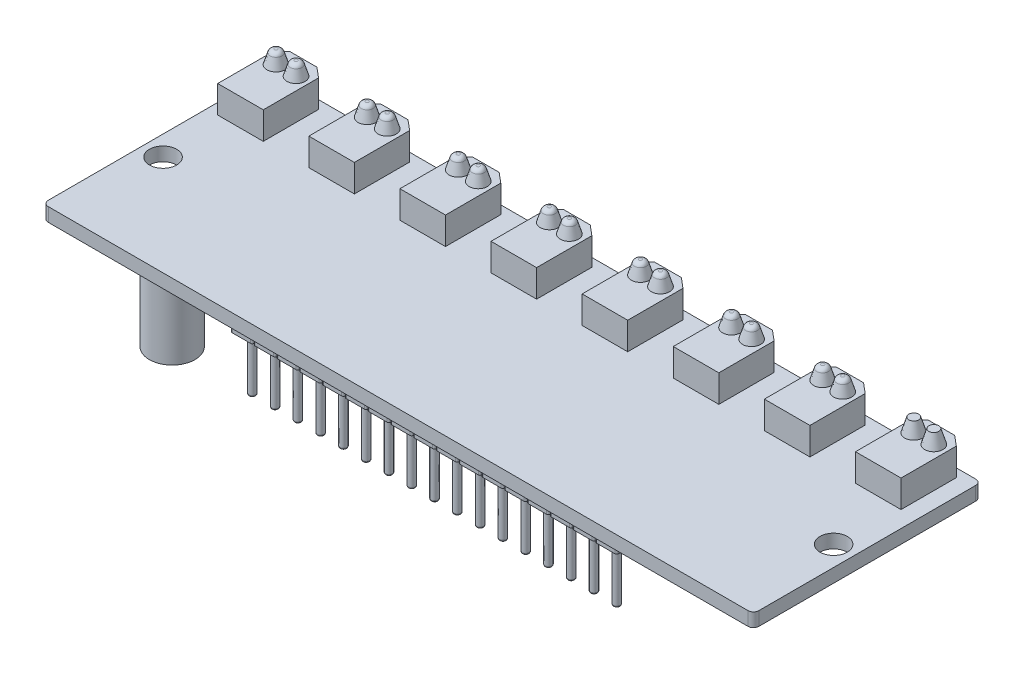
from build123d import *

# Parameters (mm, degrees)
SKETCH1_W                      = 78
SKETCH1_H                      = 25
BOSS_EXTRUDE1_DEPTH            = 1.5
FILLET1_R                      = 0.6
SKETCH2_R                      = 1.5
CUT_EXTRUDE1_DEPTH             = 1.5
BOSS_EXTRUDE2_DEPTH            = 3
SKETCH4_R                      = 1
BOSS_EXTRUDE7_DEPTH            = 1.5
BOSS_EXTRUDE7_DRAFT            = 17
BOSS_EXTRUDE7_PROFILE_2_DEPTH  = 1.5
BOSS_EXTRUDE7_PROFILE_2_DRAFT  = 17
BOSS_EXTRUDE7_PROFILE_3_DEPTH  = 1.5
BOSS_EXTRUDE7_PROFILE_3_DRAFT  = 17
BOSS_EXTRUDE7_PROFILE_4_DEPTH  = 1.5
BOSS_EXTRUDE7_PROFILE_4_DRAFT  = 17
BOSS_EXTRUDE7_PROFILE_5_DEPTH  = 1.5
BOSS_EXTRUDE7_PROFILE_5_DRAFT  = 17
BOSS_EXTRUDE7_PROFILE_6_DEPTH  = 1.5
BOSS_EXTRUDE7_PROFILE_6_DRAFT  = 17
BOSS_EXTRUDE7_PROFILE_7_DEPTH  = 1.5
BOSS_EXTRUDE7_PROFILE_7_DRAFT  = 17
BOSS_EXTRUDE7_PROFILE_8_DEPTH  = 1.5
BOSS_EXTRUDE7_PROFILE_8_DRAFT  = 17
BOSS_EXTRUDE7_PROFILE_9_DEPTH  = 1.5
BOSS_EXTRUDE7_PROFILE_9_DRAFT  = 17
BOSS_EXTRUDE7_PROFILE_10_DEPTH = 1.5
BOSS_EXTRUDE7_PROFILE_10_DRAFT = 17
BOSS_EXTRUDE7_PROFILE_11_DEPTH = 1.5
BOSS_EXTRUDE7_PROFILE_11_DRAFT = 17
BOSS_EXTRUDE7_PROFILE_12_DEPTH = 1.5
BOSS_EXTRUDE7_PROFILE_12_DRAFT = 17
BOSS_EXTRUDE7_PROFILE_13_DEPTH = 1.5
BOSS_EXTRUDE7_PROFILE_13_DRAFT = 17
BOSS_EXTRUDE7_PROFILE_14_DEPTH = 1.5
BOSS_EXTRUDE7_PROFILE_14_DRAFT = 17
BOSS_EXTRUDE7_PROFILE_15_DEPTH = 1.5
BOSS_EXTRUDE7_PROFILE_15_DRAFT = 17
BOSS_EXTRUDE7_PROFILE_16_DEPTH = 1.5
BOSS_EXTRUDE7_PROFILE_16_DRAFT = 17
FILLET4_R                      = 0.5
SKETCH5_W                      = 2.4
SKETCH5_H                      = 2.4
BOSS_EXTRUDE12_DEPTH           = 2
SKETCH6_R                      = 0.375
BOSS_EXTRUDE13_DEPTH           = 6
FILLET5_R                      = 0.2
FILLET7_R                      = 0.2
FILLET8_R                      = 0.2
SKETCH7_R                      = 2.5
BOSS_EXTRUDE14_DEPTH           = 10


with BuildPart() as part:
    # Sketch1 → Boss-Extrude1 (new body)
    with BuildSketch(Plane(origin=(0, 0, 0), x_dir=(1, 0, 0), z_dir=(0, 1, 0))):
        Rectangle(SKETCH1_W, SKETCH1_H)
    extrude(amount=BOSS_EXTRUDE1_DEPTH)

    # Fillet1
    fillet1_edges = [part.edges().sort_by_distance(p)[0] for p in [
        (-39, 0.75, -12.5),
        (39, 0.75, -12.5),
        (39, 0.75, 12.5),
        (-39, 0.75, 12.5),
    ]]
    fillet(fillet1_edges, radius=FILLET1_R)

    # Sketch2 → Cut-Extrude1 (cut)
    with BuildSketch(Plane(origin=(0, 1.5, 0), x_dir=(1, 0, 0), z_dir=(0, 1, 0))):
        with Locations(Location((-36.8, -1.5, 0), (0, 0, 270))):
            Circle(SKETCH2_R)
        with Locations(Location((36.8, -1.5, 0), (0, 0, 90))):
            Circle(SKETCH2_R)
    extrude(amount=-CUT_EXTRUDE1_DEPTH, mode=Mode.SUBTRACT)

    # Sketch3 → Boss-Extrude2 (add)
    with BuildSketch(Plane(origin=(0, 1.5, 0), x_dir=(1, 0, 0), z_dir=(0, 1, 0))):
        Polygon((-36.866761268, 12.5), (-33.913958089, 12.5), (-32.8, 11.566761268), (-32.8, 5.5), (-37.8, 5.5), (-37.8, 11.566761268), align=None)
        Polygon((-22.8, 11.566761268), (-22.8, 5.5), (-27.8, 5.5), (-27.8, 11.566761268), (-26.866761268, 12.5), (-23.913958089, 12.5), align=None)
        Polygon((-12.8, 11.566761268), (-12.8, 5.5), (-17.8, 5.5), (-17.8, 11.566761268), (-16.866761268, 12.5), (-13.913958089, 12.5), align=None)
        Polygon((-2.8, 11.566761268), (-2.8, 5.5), (-7.8, 5.5), (-7.8, 11.566761268), (-6.866761268, 12.5), (-3.913958089, 12.5), align=None)
        Polygon((7.2, 11.566761268), (7.2, 5.5), (2.2, 5.5), (2.2, 11.566761268), (3.133238732, 12.5), (6.086041911, 12.5), align=None)
        Polygon((17.2, 11.566761268), (17.2, 5.5), (12.2, 5.5), (12.2, 11.566761268), (13.133238732, 12.5), (16.086041911, 12.5), align=None)
        Polygon((27.2, 11.566761268), (27.2, 5.5), (22.2, 5.5), (22.2, 11.566761268), (23.133238732, 12.5), (26.086041911, 12.5), align=None)
        Polygon((37.2, 11.566761268), (37.2, 5.5), (32.2, 5.5), (32.2, 11.566761268), (33.133238732, 12.5), (36.086041911, 12.5), align=None)
    extrude(amount=BOSS_EXTRUDE2_DEPTH)


with BuildPart() as boss_extrude7_tool:
    # Sketch4 → Boss-Extrude7 (with draft: the straight prism first)
    with BuildSketch(Plane(origin=(0, 4.5, 0), x_dir=(1, 0, 0), z_dir=(0, 1, 0))):
        with Locations((-36.4, 10.499601384)):
            Circle(SKETCH4_R)
    extrude(amount=BOSS_EXTRUDE7_DEPTH)
    # Boss-Extrude7: the draft: its side faces are tilted about the plane it starts from
    boss_extrude7_sides = [boss_extrude7_tool.faces().sort_by_distance(p)[0] for p in [
        (-37.4, 5.25, -10.499601384),
    ]]
    draft(boss_extrude7_sides, Plane(origin=(0, 4.5, 0), x_dir=(1, 0, 0), z_dir=(0, 1, 0)), BOSS_EXTRUDE7_DRAFT)


with BuildPart() as part_1:
    add(part.part)

    # Boss-Extrude7: add boss_extrude7_tool
    add(boss_extrude7_tool.part)


with BuildPart() as boss_extrude7_profile_2_tool:
    # Sketch4 → Boss-Extrude7 profile 2 (with draft: the straight prism first)
    with BuildSketch(Plane(origin=(0, 4.5, 0), x_dir=(1, 0, 0), z_dir=(0, 1, 0))):
        with Locations((-34.2, 10.499601384)):
            Circle(SKETCH4_R)
    extrude(amount=BOSS_EXTRUDE7_PROFILE_2_DEPTH)
    # Boss-Extrude7 profile 2: the draft: its side faces are tilted about the plane it starts from
    boss_extrude7_profile_2_sides = [boss_extrude7_profile_2_tool.faces().sort_by_distance(p)[0] for p in [
        (-35.2, 5.25, -10.499601384),
    ]]
    draft(boss_extrude7_profile_2_sides, Plane(origin=(0, 4.5, 0), x_dir=(1, 0, 0), z_dir=(0, 1, 0)), BOSS_EXTRUDE7_PROFILE_2_DRAFT)


with BuildPart() as part_2:
    add(part_1.part)

    # Boss-Extrude7 profile 2: add boss_extrude7_profile_2_tool
    add(boss_extrude7_profile_2_tool.part)


with BuildPart() as boss_extrude7_profile_3_tool:
    # Sketch4 → Boss-Extrude7 profile 3 (with draft: the straight prism first)
    with BuildSketch(Plane(origin=(0, 4.5, 0), x_dir=(1, 0, 0), z_dir=(0, 1, 0))):
        with Locations((-26.4, 10.499601384)):
            Circle(SKETCH4_R)
    extrude(amount=BOSS_EXTRUDE7_PROFILE_3_DEPTH)
    # Boss-Extrude7 profile 3: the draft: its side faces are tilted about the plane it starts from
    boss_extrude7_profile_3_sides = [boss_extrude7_profile_3_tool.faces().sort_by_distance(p)[0] for p in [
        (-27.4, 5.25, -10.499601384),
    ]]
    draft(boss_extrude7_profile_3_sides, Plane(origin=(0, 4.5, 0), x_dir=(1, 0, 0), z_dir=(0, 1, 0)), BOSS_EXTRUDE7_PROFILE_3_DRAFT)


with BuildPart() as part_3:
    add(part_2.part)

    # Boss-Extrude7 profile 3: add boss_extrude7_profile_3_tool
    add(boss_extrude7_profile_3_tool.part)


with BuildPart() as boss_extrude7_profile_4_tool:
    # Sketch4 → Boss-Extrude7 profile 4 (with draft: the straight prism first)
    with BuildSketch(Plane(origin=(0, 4.5, 0), x_dir=(1, 0, 0), z_dir=(0, 1, 0))):
        with Locations((-24.2, 10.499601384)):
            Circle(SKETCH4_R)
    extrude(amount=BOSS_EXTRUDE7_PROFILE_4_DEPTH)
    # Boss-Extrude7 profile 4: the draft: its side faces are tilted about the plane it starts from
    boss_extrude7_profile_4_sides = [boss_extrude7_profile_4_tool.faces().sort_by_distance(p)[0] for p in [
        (-25.2, 5.25, -10.499601384),
    ]]
    draft(boss_extrude7_profile_4_sides, Plane(origin=(0, 4.5, 0), x_dir=(1, 0, 0), z_dir=(0, 1, 0)), BOSS_EXTRUDE7_PROFILE_4_DRAFT)


with BuildPart() as part_4:
    add(part_3.part)

    # Boss-Extrude7 profile 4: add boss_extrude7_profile_4_tool
    add(boss_extrude7_profile_4_tool.part)


with BuildPart() as boss_extrude7_profile_5_tool:
    # Sketch4 → Boss-Extrude7 profile 5 (with draft: the straight prism first)
    with BuildSketch(Plane(origin=(0, 4.5, 0), x_dir=(1, 0, 0), z_dir=(0, 1, 0))):
        with Locations((-16.4, 10.499601384)):
            Circle(SKETCH4_R)
    extrude(amount=BOSS_EXTRUDE7_PROFILE_5_DEPTH)
    # Boss-Extrude7 profile 5: the draft: its side faces are tilted about the plane it starts from
    boss_extrude7_profile_5_sides = [boss_extrude7_profile_5_tool.faces().sort_by_distance(p)[0] for p in [
        (-17.4, 5.25, -10.499601384),
    ]]
    draft(boss_extrude7_profile_5_sides, Plane(origin=(0, 4.5, 0), x_dir=(1, 0, 0), z_dir=(0, 1, 0)), BOSS_EXTRUDE7_PROFILE_5_DRAFT)


with BuildPart() as part_5:
    add(part_4.part)

    # Boss-Extrude7 profile 5: add boss_extrude7_profile_5_tool
    add(boss_extrude7_profile_5_tool.part)


with BuildPart() as boss_extrude7_profile_6_tool:
    # Sketch4 → Boss-Extrude7 profile 6 (with draft: the straight prism first)
    with BuildSketch(Plane(origin=(0, 4.5, 0), x_dir=(1, 0, 0), z_dir=(0, 1, 0))):
        with Locations((-14.2, 10.499601384)):
            Circle(SKETCH4_R)
    extrude(amount=BOSS_EXTRUDE7_PROFILE_6_DEPTH)
    # Boss-Extrude7 profile 6: the draft: its side faces are tilted about the plane it starts from
    boss_extrude7_profile_6_sides = [boss_extrude7_profile_6_tool.faces().sort_by_distance(p)[0] for p in [
        (-15.2, 5.25, -10.499601384),
    ]]
    draft(boss_extrude7_profile_6_sides, Plane(origin=(0, 4.5, 0), x_dir=(1, 0, 0), z_dir=(0, 1, 0)), BOSS_EXTRUDE7_PROFILE_6_DRAFT)


with BuildPart() as part_6:
    add(part_5.part)

    # Boss-Extrude7 profile 6: add boss_extrude7_profile_6_tool
    add(boss_extrude7_profile_6_tool.part)


with BuildPart() as boss_extrude7_profile_7_tool:
    # Sketch4 → Boss-Extrude7 profile 7 (with draft: the straight prism first)
    with BuildSketch(Plane(origin=(0, 4.5, 0), x_dir=(1, 0, 0), z_dir=(0, 1, 0))):
        with Locations((-6.4, 10.499601384)):
            Circle(SKETCH4_R)
    extrude(amount=BOSS_EXTRUDE7_PROFILE_7_DEPTH)
    # Boss-Extrude7 profile 7: the draft: its side faces are tilted about the plane it starts from
    boss_extrude7_profile_7_sides = [boss_extrude7_profile_7_tool.faces().sort_by_distance(p)[0] for p in [
        (-7.4, 5.25, -10.499601384),
    ]]
    draft(boss_extrude7_profile_7_sides, Plane(origin=(0, 4.5, 0), x_dir=(1, 0, 0), z_dir=(0, 1, 0)), BOSS_EXTRUDE7_PROFILE_7_DRAFT)


with BuildPart() as part_7:
    add(part_6.part)

    # Boss-Extrude7 profile 7: add boss_extrude7_profile_7_tool
    add(boss_extrude7_profile_7_tool.part)


with BuildPart() as boss_extrude7_profile_8_tool:
    # Sketch4 → Boss-Extrude7 profile 8 (with draft: the straight prism first)
    with BuildSketch(Plane(origin=(0, 4.5, 0), x_dir=(1, 0, 0), z_dir=(0, 1, 0))):
        with Locations((-4.2, 10.499601384)):
            Circle(SKETCH4_R)
    extrude(amount=BOSS_EXTRUDE7_PROFILE_8_DEPTH)
    # Boss-Extrude7 profile 8: the draft: its side faces are tilted about the plane it starts from
    boss_extrude7_profile_8_sides = [boss_extrude7_profile_8_tool.faces().sort_by_distance(p)[0] for p in [
        (-5.2, 5.25, -10.499601384),
    ]]
    draft(boss_extrude7_profile_8_sides, Plane(origin=(0, 4.5, 0), x_dir=(1, 0, 0), z_dir=(0, 1, 0)), BOSS_EXTRUDE7_PROFILE_8_DRAFT)


with BuildPart() as part_8:
    add(part_7.part)

    # Boss-Extrude7 profile 8: add boss_extrude7_profile_8_tool
    add(boss_extrude7_profile_8_tool.part)


with BuildPart() as boss_extrude7_profile_9_tool:
    # Sketch4 → Boss-Extrude7 profile 9 (with draft: the straight prism first)
    with BuildSketch(Plane(origin=(0, 4.5, 0), x_dir=(1, 0, 0), z_dir=(0, 1, 0))):
        with Locations((3.6, 10.499601384)):
            Circle(SKETCH4_R)
    extrude(amount=BOSS_EXTRUDE7_PROFILE_9_DEPTH)
    # Boss-Extrude7 profile 9: the draft: its side faces are tilted about the plane it starts from
    boss_extrude7_profile_9_sides = [boss_extrude7_profile_9_tool.faces().sort_by_distance(p)[0] for p in [
        (2.6, 5.25, -10.499601384),
    ]]
    draft(boss_extrude7_profile_9_sides, Plane(origin=(0, 4.5, 0), x_dir=(1, 0, 0), z_dir=(0, 1, 0)), BOSS_EXTRUDE7_PROFILE_9_DRAFT)


with BuildPart() as part_9:
    add(part_8.part)

    # Boss-Extrude7 profile 9: add boss_extrude7_profile_9_tool
    add(boss_extrude7_profile_9_tool.part)


with BuildPart() as boss_extrude7_profile_10_tool:
    # Sketch4 → Boss-Extrude7 profile 10 (with draft: the straight prism first)
    with BuildSketch(Plane(origin=(0, 4.5, 0), x_dir=(1, 0, 0), z_dir=(0, 1, 0))):
        with Locations((5.8, 10.499601384)):
            Circle(SKETCH4_R)
    extrude(amount=BOSS_EXTRUDE7_PROFILE_10_DEPTH)
    # Boss-Extrude7 profile 10: the draft: its side faces are tilted about the plane it starts from
    boss_extrude7_profile_10_sides = [boss_extrude7_profile_10_tool.faces().sort_by_distance(p)[0] for p in [
        (4.8, 5.25, -10.499601384),
    ]]
    draft(boss_extrude7_profile_10_sides, Plane(origin=(0, 4.5, 0), x_dir=(1, 0, 0), z_dir=(0, 1, 0)), BOSS_EXTRUDE7_PROFILE_10_DRAFT)


with BuildPart() as part_10:
    add(part_9.part)

    # Boss-Extrude7 profile 10: add boss_extrude7_profile_10_tool
    add(boss_extrude7_profile_10_tool.part)


with BuildPart() as boss_extrude7_profile_11_tool:
    # Sketch4 → Boss-Extrude7 profile 11 (with draft: the straight prism first)
    with BuildSketch(Plane(origin=(0, 4.5, 0), x_dir=(1, 0, 0), z_dir=(0, 1, 0))):
        with Locations((13.6, 10.499601384)):
            Circle(SKETCH4_R)
    extrude(amount=BOSS_EXTRUDE7_PROFILE_11_DEPTH)
    # Boss-Extrude7 profile 11: the draft: its side faces are tilted about the plane it starts from
    boss_extrude7_profile_11_sides = [boss_extrude7_profile_11_tool.faces().sort_by_distance(p)[0] for p in [
        (12.6, 5.25, -10.499601384),
    ]]
    draft(boss_extrude7_profile_11_sides, Plane(origin=(0, 4.5, 0), x_dir=(1, 0, 0), z_dir=(0, 1, 0)), BOSS_EXTRUDE7_PROFILE_11_DRAFT)


with BuildPart() as part_11:
    add(part_10.part)

    # Boss-Extrude7 profile 11: add boss_extrude7_profile_11_tool
    add(boss_extrude7_profile_11_tool.part)


with BuildPart() as boss_extrude7_profile_12_tool:
    # Sketch4 → Boss-Extrude7 profile 12 (with draft: the straight prism first)
    with BuildSketch(Plane(origin=(0, 4.5, 0), x_dir=(1, 0, 0), z_dir=(0, 1, 0))):
        with Locations((15.8, 10.499601384)):
            Circle(SKETCH4_R)
    extrude(amount=BOSS_EXTRUDE7_PROFILE_12_DEPTH)
    # Boss-Extrude7 profile 12: the draft: its side faces are tilted about the plane it starts from
    boss_extrude7_profile_12_sides = [boss_extrude7_profile_12_tool.faces().sort_by_distance(p)[0] for p in [
        (14.8, 5.25, -10.499601384),
    ]]
    draft(boss_extrude7_profile_12_sides, Plane(origin=(0, 4.5, 0), x_dir=(1, 0, 0), z_dir=(0, 1, 0)), BOSS_EXTRUDE7_PROFILE_12_DRAFT)


with BuildPart() as part_12:
    add(part_11.part)

    # Boss-Extrude7 profile 12: add boss_extrude7_profile_12_tool
    add(boss_extrude7_profile_12_tool.part)


with BuildPart() as boss_extrude7_profile_13_tool:
    # Sketch4 → Boss-Extrude7 profile 13 (with draft: the straight prism first)
    with BuildSketch(Plane(origin=(0, 4.5, 0), x_dir=(1, 0, 0), z_dir=(0, 1, 0))):
        with Locations((23.6, 10.499601384)):
            Circle(SKETCH4_R)
    extrude(amount=BOSS_EXTRUDE7_PROFILE_13_DEPTH)
    # Boss-Extrude7 profile 13: the draft: its side faces are tilted about the plane it starts from
    boss_extrude7_profile_13_sides = [boss_extrude7_profile_13_tool.faces().sort_by_distance(p)[0] for p in [
        (22.6, 5.25, -10.499601384),
    ]]
    draft(boss_extrude7_profile_13_sides, Plane(origin=(0, 4.5, 0), x_dir=(1, 0, 0), z_dir=(0, 1, 0)), BOSS_EXTRUDE7_PROFILE_13_DRAFT)


with BuildPart() as part_13:
    add(part_12.part)

    # Boss-Extrude7 profile 13: add boss_extrude7_profile_13_tool
    add(boss_extrude7_profile_13_tool.part)


with BuildPart() as boss_extrude7_profile_14_tool:
    # Sketch4 → Boss-Extrude7 profile 14 (with draft: the straight prism first)
    with BuildSketch(Plane(origin=(0, 4.5, 0), x_dir=(1, 0, 0), z_dir=(0, 1, 0))):
        with Locations((25.8, 10.499601384)):
            Circle(SKETCH4_R)
    extrude(amount=BOSS_EXTRUDE7_PROFILE_14_DEPTH)
    # Boss-Extrude7 profile 14: the draft: its side faces are tilted about the plane it starts from
    boss_extrude7_profile_14_sides = [boss_extrude7_profile_14_tool.faces().sort_by_distance(p)[0] for p in [
        (24.8, 5.25, -10.499601384),
    ]]
    draft(boss_extrude7_profile_14_sides, Plane(origin=(0, 4.5, 0), x_dir=(1, 0, 0), z_dir=(0, 1, 0)), BOSS_EXTRUDE7_PROFILE_14_DRAFT)


with BuildPart() as part_14:
    add(part_13.part)

    # Boss-Extrude7 profile 14: add boss_extrude7_profile_14_tool
    add(boss_extrude7_profile_14_tool.part)


with BuildPart() as boss_extrude7_profile_15_tool:
    # Sketch4 → Boss-Extrude7 profile 15 (with draft: the straight prism first)
    with BuildSketch(Plane(origin=(0, 4.5, 0), x_dir=(1, 0, 0), z_dir=(0, 1, 0))):
        with Locations((33.6, 10.499601384)):
            Circle(SKETCH4_R)
    extrude(amount=BOSS_EXTRUDE7_PROFILE_15_DEPTH)
    # Boss-Extrude7 profile 15: the draft: its side faces are tilted about the plane it starts from
    boss_extrude7_profile_15_sides = [boss_extrude7_profile_15_tool.faces().sort_by_distance(p)[0] for p in [
        (32.6, 5.25, -10.499601384),
    ]]
    draft(boss_extrude7_profile_15_sides, Plane(origin=(0, 4.5, 0), x_dir=(1, 0, 0), z_dir=(0, 1, 0)), BOSS_EXTRUDE7_PROFILE_15_DRAFT)


with BuildPart() as part_15:
    add(part_14.part)

    # Boss-Extrude7 profile 15: add boss_extrude7_profile_15_tool
    add(boss_extrude7_profile_15_tool.part)


with BuildPart() as boss_extrude7_profile_16_tool:
    # Sketch4 → Boss-Extrude7 profile 16 (with draft: the straight prism first)
    with BuildSketch(Plane(origin=(0, 4.5, 0), x_dir=(1, 0, 0), z_dir=(0, 1, 0))):
        with Locations((35.8, 10.499601384)):
            Circle(SKETCH4_R)
    extrude(amount=BOSS_EXTRUDE7_PROFILE_16_DEPTH)
    # Boss-Extrude7 profile 16: the draft: its side faces are tilted about the plane it starts from
    boss_extrude7_profile_16_sides = [boss_extrude7_profile_16_tool.faces().sort_by_distance(p)[0] for p in [
        (34.8, 5.25, -10.499601384),
    ]]
    draft(boss_extrude7_profile_16_sides, Plane(origin=(0, 4.5, 0), x_dir=(1, 0, 0), z_dir=(0, 1, 0)), BOSS_EXTRUDE7_PROFILE_16_DRAFT)


with BuildPart() as part_16:
    add(part_15.part)

    # Boss-Extrude7 profile 16: add boss_extrude7_profile_16_tool
    add(boss_extrude7_profile_16_tool.part)

    # Fillet4
    fillet4_edges = [part_16.edges().sort_by_distance(p)[0] for p in [
        (-36.941403978, 6, -10.499601384),
        (-34.741403978, 6, -10.499601384),
        (-26.941403978, 6, -10.499601384),
        (-24.741403978, 6, -10.499601384),
        (-16.941403978, 6, -10.499601384),
        (-14.741403978, 6, -10.499601384),
        (-6.941403978, 6, -10.499601384),
        (-4.741403978, 6, -10.499601384),
        (3.058596022, 6, -10.499601384),
        (5.258596022, 6, -10.499601384),
        (13.058596022, 6, -10.499601384),
        (15.258596022, 6, -10.499601384),
        (23.058596022, 6, -10.499601384),
        (25.258596022, 6, -10.499601384),
    ]]
    fillet(fillet4_edges, radius=FILLET4_R)

    # Sketch5 → Boss-Extrude12 (add)
    with BuildSketch(Plane.XZ):
        with Locations((-16.3, 9.7)):
            Rectangle(SKETCH5_W, SKETCH5_H)
        with Locations((-13.8, 9.7)):
            Rectangle(SKETCH5_W, SKETCH5_H)
        with Locations((-11.3, 9.7)):
            Rectangle(SKETCH5_W, SKETCH5_H)
        with Locations((-8.8, 9.7)):
            Rectangle(SKETCH5_W, SKETCH5_H)
        with Locations((-6.3, 9.7)):
            Rectangle(SKETCH5_W, SKETCH5_H)
        with Locations((-18.8, 9.7)):
            Rectangle(SKETCH5_W, SKETCH5_H)
        with Locations((-3.8, 9.7)):
            Rectangle(SKETCH5_W, SKETCH5_H)
        with Locations((-1.3, 9.7)):
            Rectangle(SKETCH5_W, SKETCH5_H)
        with Locations((1.2, 9.7)):
            Rectangle(SKETCH5_W, SKETCH5_H)
        with Locations((3.7, 9.7)):
            Rectangle(SKETCH5_W, SKETCH5_H)
        with Locations((6.2, 9.7)):
            Rectangle(SKETCH5_W, SKETCH5_H)
        with Locations((8.7, 9.7)):
            Rectangle(SKETCH5_W, SKETCH5_H)
        with Locations((11.2, 9.7)):
            Rectangle(SKETCH5_W, SKETCH5_H)
        with Locations((13.7, 9.7)):
            Rectangle(SKETCH5_W, SKETCH5_H)
        with Locations((16.2, 9.7)):
            Rectangle(SKETCH5_W, SKETCH5_H)
        with Locations((18.7, 9.7)):
            Rectangle(SKETCH5_W, SKETCH5_H)
        with Locations((21.2, 9.7)):
            Rectangle(SKETCH5_W, SKETCH5_H)
    extrude(amount=BOSS_EXTRUDE12_DEPTH)

    # Sketch6 → Boss-Extrude13 (add)
    with BuildSketch(Plane.XZ.offset(2)):
        with Locations(Location((-18.8, 9.7, 0), (0, 0, 270))):
            Circle(SKETCH6_R)
        with Locations(Location((-16.3, 9.7, 0), (0, 0, 270))):
            Circle(SKETCH6_R)
        with Locations(Location((-13.8, 9.7, 0), (0, 0, 270))):
            Circle(SKETCH6_R)
        with Locations(Location((-11.3, 9.7, 0), (0, 0, 270))):
            Circle(SKETCH6_R)
        with Locations(Location((-8.8, 9.7, 0), (0, 0, 270))):
            Circle(SKETCH6_R)
        with Locations(Location((-6.3, 9.7, 0), (0, 0, 270))):
            Circle(SKETCH6_R)
        with Locations(Location((-3.8, 9.7, 0), (0, 0, 270))):
            Circle(SKETCH6_R)
        with Locations(Location((-1.3, 9.7, 0), (0, 0, 270))):
            Circle(SKETCH6_R)
        with Locations(Location((1.2, 9.7, 0), (0, 0, 270))):
            Circle(SKETCH6_R)
        with Locations(Location((3.7, 9.7, 0), (0, 0, 270))):
            Circle(SKETCH6_R)
        with Locations(Location((6.2, 9.7, 0), (0, 0, 270))):
            Circle(SKETCH6_R)
        with Locations(Location((8.7, 9.7, 0), (0, 0, 270))):
            Circle(SKETCH6_R)
        with Locations(Location((11.2, 9.7, 0), (0, 0, 270))):
            Circle(SKETCH6_R)
        with Locations(Location((13.7, 9.7, 0), (0, 0, 270))):
            Circle(SKETCH6_R)
        with Locations(Location((16.2, 9.7, 0), (0, 0, 270))):
            Circle(SKETCH6_R)
        with Locations(Location((18.7, 9.7, 0), (0, 0, 270))):
            Circle(SKETCH6_R)
        with Locations(Location((21.2, 9.7, 0), (0, 0, 270))):
            Circle(SKETCH6_R)
    extrude(amount=BOSS_EXTRUDE13_DEPTH)

    # Fillet5
    fillet5_edges = [part_16.edges().sort_by_distance(p)[0] for p in [
        (-17.6, -1, 10.9),
        (-20, -1, 10.9),
        (-20, -1, 8.5),
        (-17.6, -1, 8.5),
    ]]
    fillet(fillet5_edges, radius=FILLET5_R)

    # Fillet7
    fillet7_edges = [part_16.edges().sort_by_distance(p)[0] for p in [
        (-15.1, -1, 10.9),
        (-17.5, -1, 10.9),
        (-17.5, -1, 8.5),
        (-15.1, -1, 8.5),
        (-12.6, -1, 10.9),
        (-15, -1, 10.9),
        (-15, -1, 8.5),
        (-12.6, -1, 8.5),
        (-10.1, -1, 10.9),
        (-12.5, -1, 10.9),
        (-12.5, -1, 8.5),
        (-10.1, -1, 8.5),
        (-7.6, -1, 10.9),
        (-10, -1, 10.9),
        (-10, -1, 8.5),
        (-7.6, -1, 8.5),
        (-5.1, -1, 10.9),
        (-7.5, -1, 10.9),
        (-7.5, -1, 8.5),
        (-5.1, -1, 8.5),
        (-2.6, -1, 10.9),
        (-5, -1, 10.9),
        (-5, -1, 8.5),
        (-2.6, -1, 8.5),
        (-0.1, -1, 10.9),
        (-2.5, -1, 10.9),
        (-2.5, -1, 8.5),
        (-0.1, -1, 8.5),
        (2.4, -1, 10.9),
        (0, -1, 10.9),
        (0, -1, 8.5),
        (2.4, -1, 8.5),
        (4.9, -1, 10.9),
        (2.5, -1, 10.9),
        (2.5, -1, 8.5),
        (4.9, -1, 8.5),
        (7.4, -1, 10.9),
        (5, -1, 10.9),
        (5, -1, 8.5),
        (7.4, -1, 8.5),
        (9.9, -1, 10.9),
        (7.5, -1, 10.9),
        (7.5, -1, 8.5),
        (9.9, -1, 8.5),
        (12.4, -1, 10.9),
        (10, -1, 10.9),
        (10, -1, 8.5),
        (12.4, -1, 8.5),
        (14.9, -1, 10.9),
        (12.5, -1, 10.9),
        (12.5, -1, 8.5),
        (14.9, -1, 8.5),
        (17.4, -1, 10.9),
        (15, -1, 10.9),
        (15, -1, 8.5),
        (17.4, -1, 8.5),
        (19.9, -1, 10.9),
        (17.5, -1, 10.9),
        (17.5, -1, 8.5),
        (19.9, -1, 8.5),
        (22.4, -1, 10.9),
        (20, -1, 10.9),
        (20, -1, 8.5),
        (22.4, -1, 8.5),
    ]]
    fillet(fillet7_edges, radius=FILLET7_R)

    # Fillet8
    fillet8_edges = [part_16.edges().sort_by_distance(p)[0] for p in [
        (-18.8, -8, 10.075),
        (-16.3, -8, 10.075),
        (-13.8, -8, 10.075),
        (-11.3, -8, 10.075),
        (-8.8, -8, 10.075),
        (-6.3, -8, 10.075),
        (-3.8, -8, 10.075),
        (-1.3, -8, 10.075),
        (1.2, -8, 10.075),
        (3.7, -8, 10.075),
        (6.2, -8, 10.075),
        (8.7, -8, 10.075),
        (11.2, -8, 10.075),
        (13.7, -8, 10.075),
        (16.2, -8, 10.075),
        (18.7, -8, 10.075),
        (21.2, -8, 10.075),
    ]]
    fillet(fillet8_edges, radius=FILLET8_R)

    # Sketch7 → Boss-Extrude14 (add)
    with BuildSketch(Plane.XZ):
        with Locations(Location((-29.8, 7.5, 0), (0, 0, 90))):
            Circle(SKETCH7_R)
    extrude(amount=BOSS_EXTRUDE14_DEPTH)


solid = part_16.part
